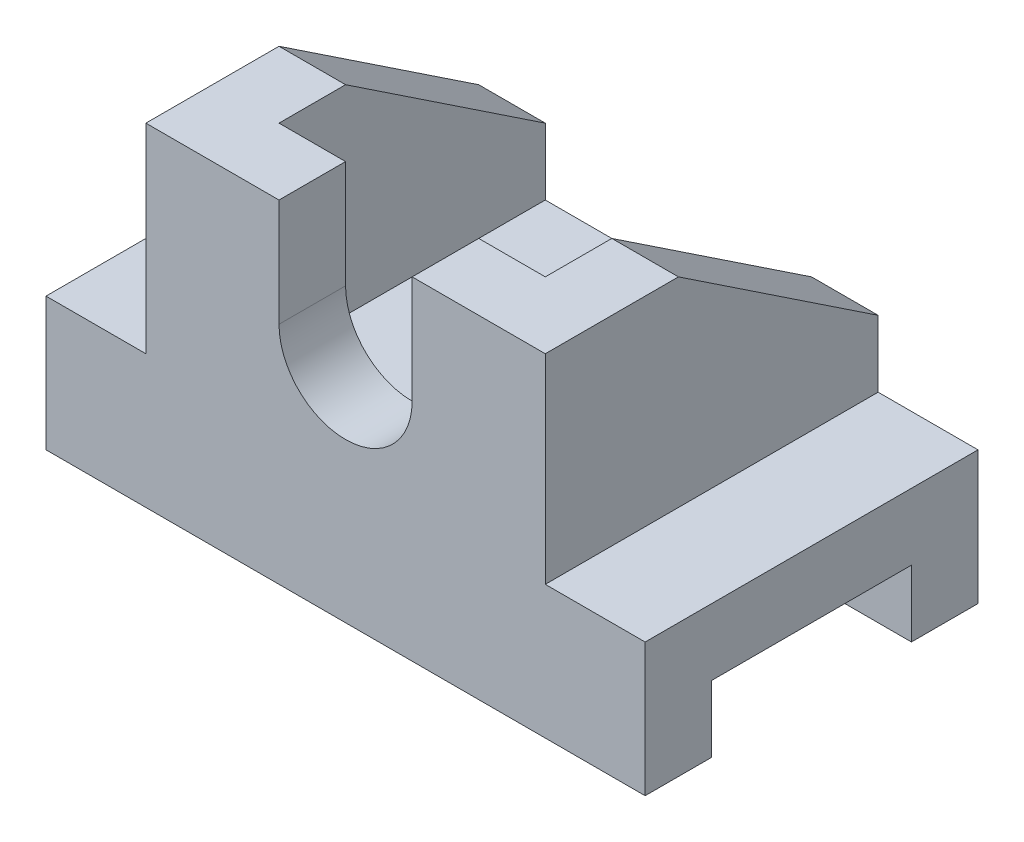
from build123d import *

# Parameters (mm, degrees)
BOSS_EXTRUDE1_DEPTH = 45
SKETCH2_W           = 60
SKETCH2_H           = 30
BOSS_EXTRUDE2_DEPTH = 10
CUT_EXTRUDE1_DEPTH  = 79.262379212
SKETCH4_R           = 10
CUT_EXTRUDE2_DEPTH  = 10
BOSS_EXTRUDE3_DEPTH = 10


with BuildPart() as part:
    # Sketch1 → Boss-Extrude1 (new, symmetric)
    with BuildSketch(Plane(origin=(0, 0, 0), x_dir=(0, 0, -1), z_dir=(1, 0, 0))):
        Polygon((-14.659090909, 0), (15.340909091, 0), (15.340909091, -10), (25.340909091, -10), (25.340909091, 10), (-24.659090909, 10), (-24.659090909, -10), (-14.659090909, -10), align=None)
    extrude(amount=BOSS_EXTRUDE1_DEPTH, both=True)

    # Sketch2 → Boss-Extrude2 (add)
    with BuildSketch(Plane.XY.offset(24.659090909)):
        with Locations((0, 25)):
            Rectangle(SKETCH2_W, SKETCH2_H)
    extrude(amount=-BOSS_EXTRUDE2_DEPTH)

    # Sketch3 → Cut-Extrude1 (cut, through all)
    with BuildSketch(Plane.XY.offset(24.659090909)):
        with BuildLine():
            Line((-10, 23.834240346), (-10, 40))
            Line((-10, 40), (10, 40))
            Line((10, 40), (10, 23.834240346))
            ThreePointArc((10, 23.834240346), (0, 13.834240346), (-10, 23.834240346))
        make_face()
    extrude(amount=-CUT_EXTRUDE1_DEPTH, mode=Mode.SUBTRACT)

    # Sketch4 → Cut-Extrude2 (cut)
    with BuildSketch(Plane(origin=(0, 10, 0), x_dir=(1, 0, 0), z_dir=(0, 1, 0))):
        with Locations(Location((0, 5.340909091, 0), (0, 0, 270))):
            Circle(SKETCH4_R)
    extrude(amount=-CUT_EXTRUDE2_DEPTH, mode=Mode.SUBTRACT)

    # Sketch5 → Boss-Extrude3 (add)
    with BuildSketch(Plane(origin=(30, 0, 0), x_dir=(0, 0, -1), z_dir=(1, 0, 0))):
        Polygon((-14.659090909, 10), (25.340909091, 10), (25.340909091, 20), (-4.659090909, 40), (-14.659090909, 40), align=None)
    extrude(amount=-BOSS_EXTRUDE3_DEPTH)

    # Mirror1: part across plane


with BuildPart() as part_1:
    add(part.part)
    add(part.part.mirror(Plane(origin=(0, 0, 0), x_dir=(0, 0, 1), z_dir=(1, 0, 0))))


solid = part_1.part
